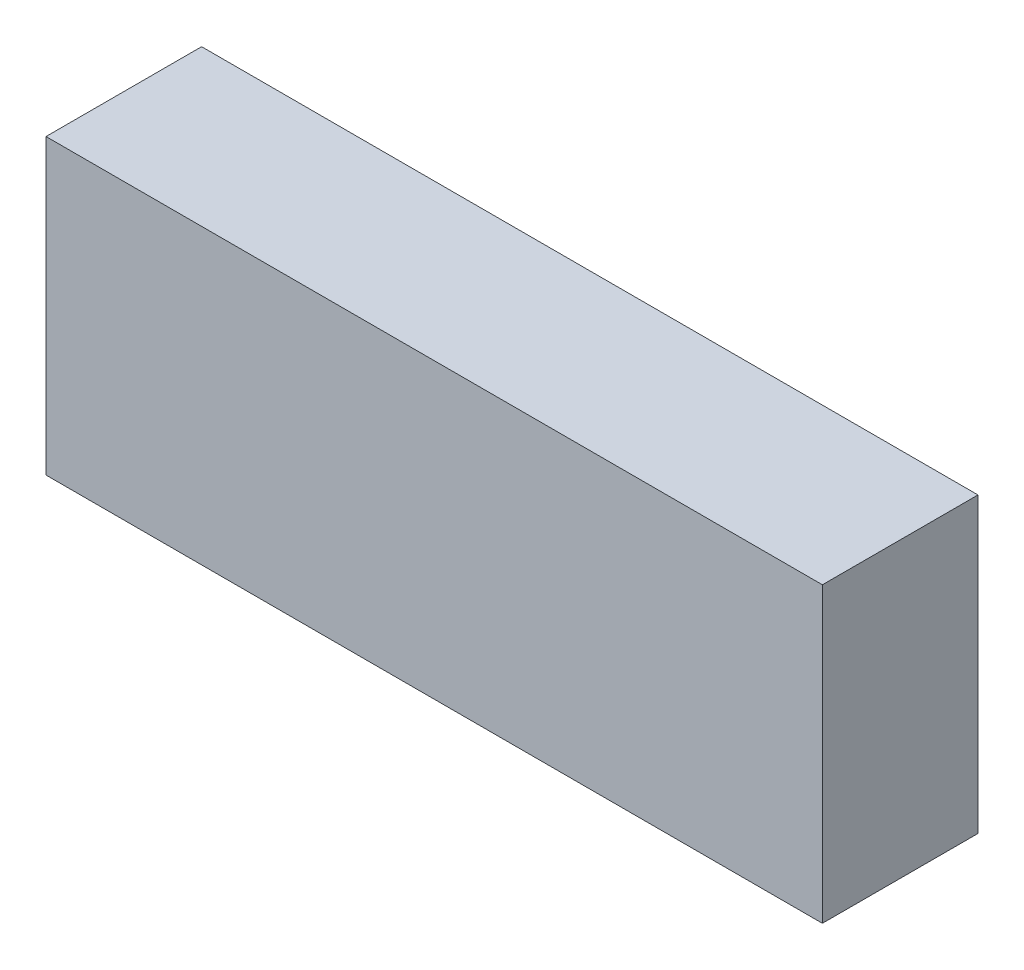
from build123d import *

# Parameters (mm, degrees)
SKETCH1_W           = 47.4
SKETCH1_H           = 17.9
BOSS_EXTRUDE1_DEPTH = 9.5


with BuildPart() as part:
    # Sketch1 → Boss-Extrude1 (new body)
    with BuildSketch(Plane.XY):
        with Locations((23.7, 8.95)):
            Rectangle(SKETCH1_W, SKETCH1_H)
    extrude(amount=BOSS_EXTRUDE1_DEPTH)


solid = part.part
